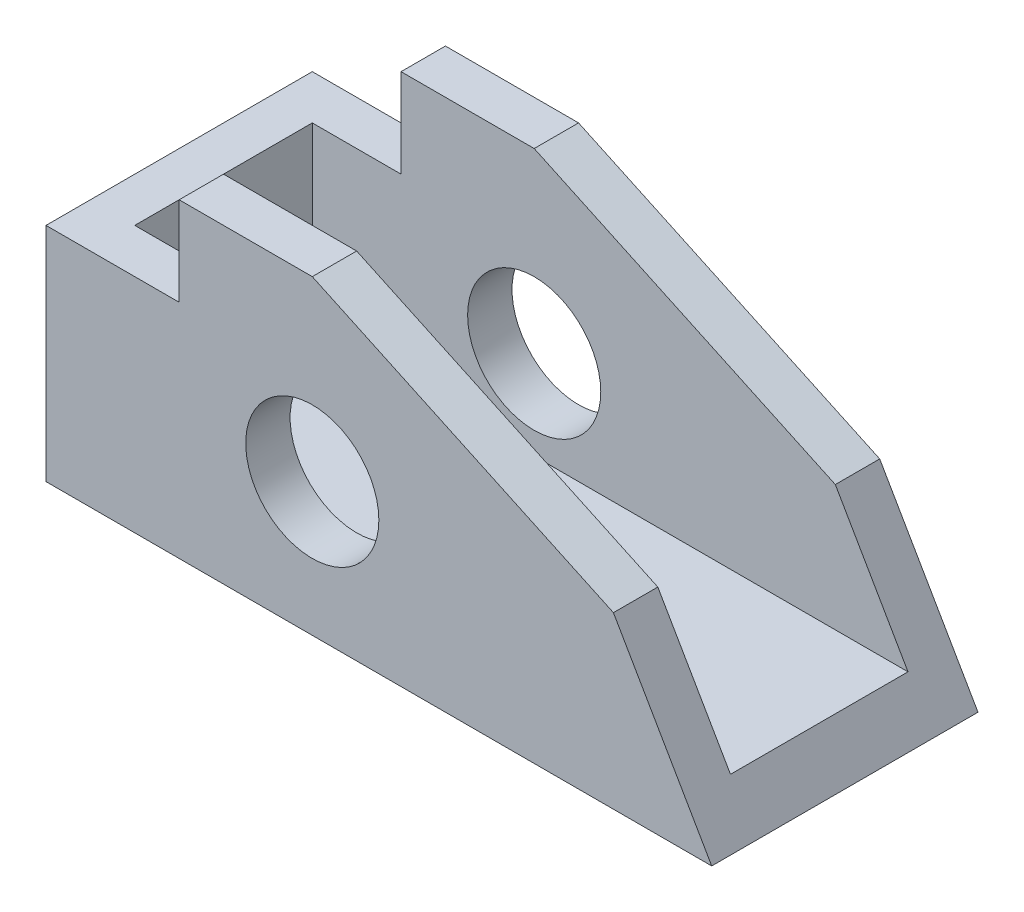
from build123d import *

# Parameters (mm, degrees)
SKETCH1_W                   = 95.25
SKETCH1_H                   = 38.1
BOSS_EXTRUDE1_DEPTH         = 44.45
F_3_4_0_75_DIAMETER_HOLE1_D = 19.05
SKETCH4_W                   = 19.05
SKETCH4_H                   = 38.1
CUT_EXTRUDE1_DEPTH          = 12.7
CUT_EXTRUDE2_REACH          = 113.803
CUT_EXTRUDE3_REACH          = 113.803
SKETCH7_W                   = 88.9
SKETCH7_H                   = 25.4
CUT_EXTRUDE4_DEPTH          = 38.1


with BuildPart() as part:
    # Sketch1 → Boss-Extrude1 (new body)
    with BuildSketch(Plane(origin=(0, 0, 0), x_dir=(1, 0, 0), z_dir=(0, 1, 0))):
        with Locations((47.625, 19.05)):
            Rectangle(SKETCH1_W, SKETCH1_H)
    extrude(amount=BOSS_EXTRUDE1_DEPTH)

    # 3/4 (0.75) Diameter Hole1 (through all)
    with Locations(Plane.XY):
        with Locations((38.1, 19.05)):
            Hole(F_3_4_0_75_DIAMETER_HOLE1_D / 2)

    # Sketch4 → Cut-Extrude1 (cut)
    with BuildSketch(Plane(origin=(0, 44.45, 0), x_dir=(1, 0, 0), z_dir=(0, 1, 0))):
        with Locations((9.525, 19.05)):
            Rectangle(SKETCH4_W, SKETCH4_H)
    extrude(amount=-CUT_EXTRUDE1_DEPTH, mode=Mode.SUBTRACT)

    # Sketch5 → Cut-Extrude2 (cut, up to next)
    with BuildSketch(Plane.XY, mode=Mode.PRIVATE) as cut_extrude2_sk1:
        Polygon((38.1, 44.45), (95.25, 17.800517336), (95.25, 44.45), align=None)
    cut_extrude2_tool1 = extrude(cut_extrude2_sk1.sketch, amount=-CUT_EXTRUDE2_REACH, mode=Mode.PRIVATE) & part.part
    add(cut_extrude2_tool1.solids().sort_by_distance((76.2, 35.566839, 0))[0], mode=Mode.SUBTRACT)

    # Sketch6 → Cut-Extrude3 (cut, up to next)
    with BuildSketch(Plane.XY, mode=Mode.PRIVATE) as cut_extrude3_sk1:
        Polygon((95.25, 0), (81.186706555, 24.358338769), (95.25, 24.358338769), align=None)
    cut_extrude3_tool1 = extrude(cut_extrude3_sk1.sketch, amount=-CUT_EXTRUDE3_REACH, mode=Mode.PRIVATE) & part.part
    add(cut_extrude3_tool1.solids().sort_by_distance((90.562236, 16.238893, 0))[0], mode=Mode.SUBTRACT)

    # Sketch7 → Cut-Extrude4 (cut)
    with BuildSketch(Plane(origin=(0, 44.45, 0), x_dir=(1, 0, 0), z_dir=(0, 1, 0))):
        with Locations((50.8, 19.05)):
            Rectangle(SKETCH7_W, SKETCH7_H)
    extrude(amount=-CUT_EXTRUDE4_DEPTH, mode=Mode.SUBTRACT)


solid = part.part
